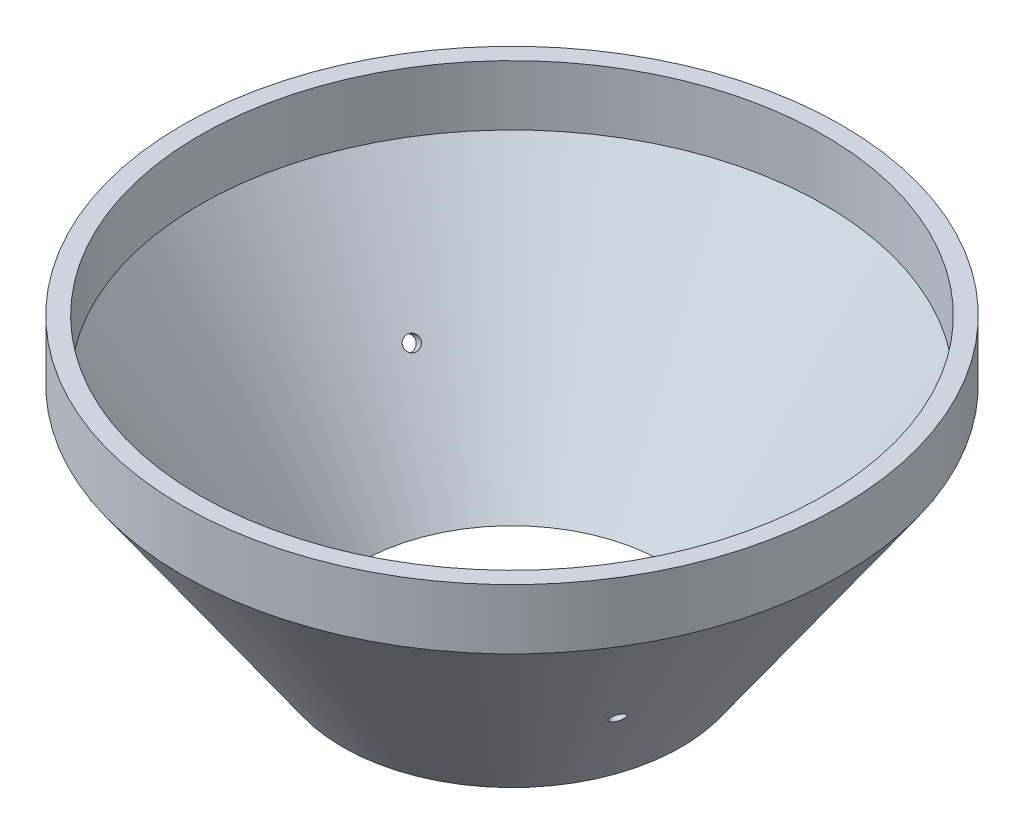
from build123d import *

# Parameters (mm, degrees)
SKETCH26_R                       = 27.463437659
BOSS_EXTRUDE1_DEPTH              = 5
SKETCH27_R                       = 25.998508152
CUT_EXTRUDE1_DEPTH               = 5
F_0_55_0_55_DIAMETER_HOLE2_D     = 1.17
F_0_55_0_55_DIAMETER_HOLE2_DEPTH = 2
F_0_55_0_55_DIAMETER_HOLE2_TIP   = 0.351503462
F_0_55_0_55_DIAMETER_HOLE4_D     = 1.17
F_0_55_0_55_DIAMETER_HOLE4_DEPTH = 2
F_0_55_0_55_DIAMETER_HOLE4_TIP   = 0.351503462


with BuildPart() as part:
    # Sketch23 → Revolve3 (revolve)
    with BuildSketch(Plane(origin=(0, 0, 0), x_dir=(-1, 0, 0), z_dir=(0, 0, -1)), mode=Mode.PRIVATE) as revolve3_sk:
        Polygon((0, 24.895699348), (-27.463437659, 24.895699348), (-14.091987401, 5.799289315), (0, 5.799289315), align=None)
    revolve(revolve3_sk.sketch.rotate(Axis((0, 0, 0), (0, 1, 0)), 90), axis=Axis((0, 0, 0), (0, 1, 0)))

    # Sketch25 → Cut-Revolve3 (revolve, cut)
    with BuildSketch(Plane(origin=(0, 0, 0), x_dir=(-1, 0, 0), z_dir=(0, 0, -1)), mode=Mode.PRIVATE) as cut_revolve3_sk:
        Polygon((0, 30), (-29.6127402, 30.057357644), (-10.448606131, 2.688137772), (0, 2.666892546), align=None)
    revolve(cut_revolve3_sk.sketch.rotate(Axis((0, 0, 0), (0, 1, 0)), 270), axis=Axis((0, 0, 0), (0, 1, 0)), mode=Mode.SUBTRACT)

    # Sketch26 → Boss-Extrude1 (add)
    with BuildSketch(Plane(origin=(0, 24.895699348, 0), x_dir=(1, 0, 0), z_dir=(0, 1, 0))):
        with Locations(Location((0, 0, 0), (0, 0, 270))):
            Circle(SKETCH26_R)
    extrude(amount=BOSS_EXTRUDE1_DEPTH)

    # Sketch27 → Cut-Extrude1 (cut)
    with BuildSketch(Plane(origin=(0, 29.895699348, 0), x_dir=(1, 0, 0), z_dir=(0, 1, 0))):
        with Locations(Location((0, 0, 0), (0, 0, 270))):
            Circle(SKETCH27_R)
    extrude(amount=-CUT_EXTRUDE1_DEPTH, mode=Mode.SUBTRACT)

    # Ø0.55 (0.55) Diameter Hole2
    with Locations(Plane(origin=(17.902646224, 14.36906592, 9.121853864), x_dir=(0.617893015445, 0.786262183666, 0), z_dir=(0.729869815764, -0.573576436351, 0.371887245949))):
        with Locations((0, 0)):
            Hole(F_0_55_0_55_DIAMETER_HOLE2_D / 2, depth=F_0_55_0_55_DIAMETER_HOLE2_DEPTH)
            with Locations((0, 0, -(F_0_55_0_55_DIAMETER_HOLE2_DEPTH + F_0_55_0_55_DIAMETER_HOLE2_TIP / 2))):  # 118° drill point
                Cone(0, F_0_55_0_55_DIAMETER_HOLE2_D / 2, F_0_55_0_55_DIAMETER_HOLE2_TIP, mode=Mode.SUBTRACT)

    # Ø0.55 (0.55) Diameter Hole4
    with Locations(Plane(origin=(-17.902646224, 14.36906592, -9.121853864), x_dir=(0.617893015445, -0.786262183666, 0), z_dir=(-0.729869815764, -0.573576436351, -0.371887245949))):
        with Locations((0, 0)):
            Hole(F_0_55_0_55_DIAMETER_HOLE4_D / 2, depth=F_0_55_0_55_DIAMETER_HOLE4_DEPTH)
            with Locations((0, 0, -(F_0_55_0_55_DIAMETER_HOLE4_DEPTH + F_0_55_0_55_DIAMETER_HOLE4_TIP / 2))):  # 118° drill point
                Cone(0, F_0_55_0_55_DIAMETER_HOLE4_D / 2, F_0_55_0_55_DIAMETER_HOLE4_TIP, mode=Mode.SUBTRACT)


solid = part.part
